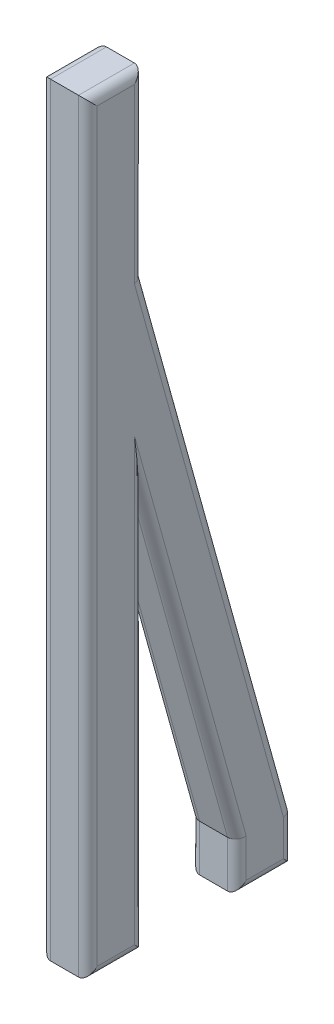
from build123d import *

# Parameters (mm, degrees)
SKETCH1_W           = 12
SKETCH1_H           = 164
BOSS_EXTRUDE1_DEPTH = 5
FILLET1_R           = 2


with BuildPart() as part:
    # Sketch1 → Boss-Extrude1 (new, symmetric)
    with BuildSketch(Plane(origin=(0, 0, 0), x_dir=(0, 0, -1), z_dir=(1, 0, 0))):
        Polygon((38, -72), (6, 43.2), (6, 0), (26, -72), (26, -82), (38, -82), align=None)
        Rectangle(SKETCH1_W, SKETCH1_H)
    extrude(amount=BOSS_EXTRUDE1_DEPTH, both=True)

    # Fillet1
    fillet1_edges = [part.edges().sort_by_distance(p)[0] for p in [
        (5, -77, -26),
        (-5, -41, -6),
        (-5, -82, 0),
        (-5, 0, 6),
        (-5, 82, 0),
        (-5, 62.6, -6),
        (-5, -14.4, -22),
        (-5, -77, -38),
        (5, -82, -32),
        (-5, -82, -32),
        (-5, -77, -26),
        (-5, -36, -16),
        (5, -77, -38),
        (5, -14.4, -22),
        (5, 62.6, -6),
        (5, 82, 0),
        (5, 0, 6),
        (5, -82, 0),
        (5, -36, -16),
        (5, -41, -6),
    ]]
    fillet(fillet1_edges, radius=FILLET1_R)


solid = part.part
